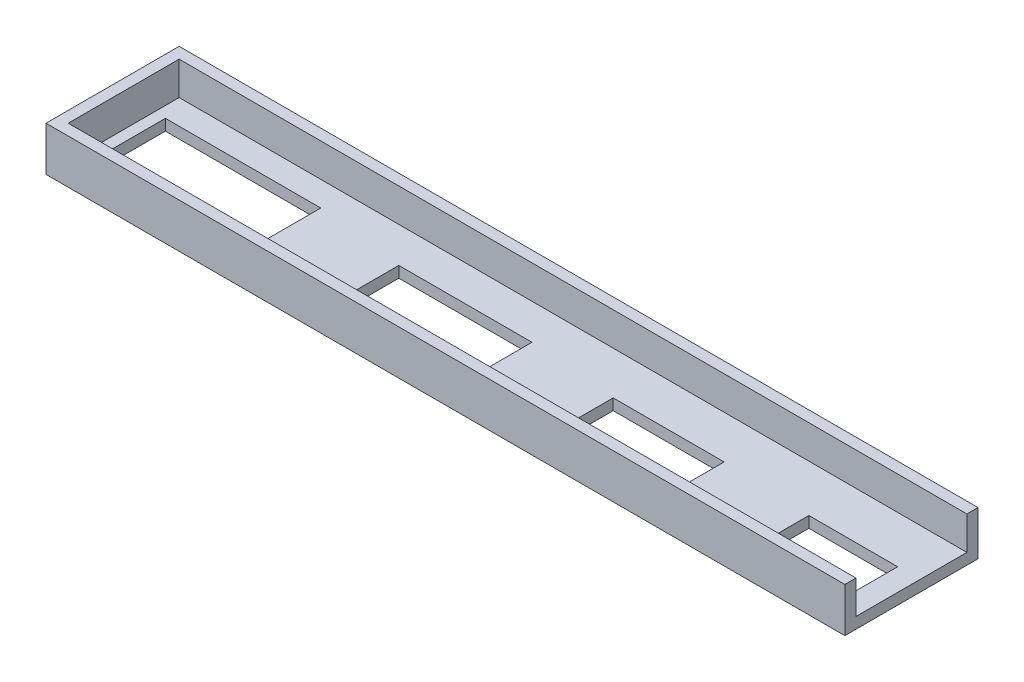
from build123d import *

# Parameters (mm, degrees)
SKETCH1_W           = 228.6
SKETCH1_H           = 38.1
BOSS_EXTRUDE1_DEPTH = 12.7
SHELL1_T            = -3.175
SKETCH3_W           = 3.175
SKETCH3_H           = 31.75
CUT_EXTRUDE1_DEPTH  = 9.525
SKETCH4_W           = 25.4
SKETCH4_H           = 16.383
SKETCH4_W_2         = 31.75
SKETCH4_H_2         = 17.526
SKETCH4_W_3         = 38.1
SKETCH4_H_3         = 19.685
SKETCH4_W_4         = 44.45
SKETCH4_H_4         = 22.733
CUT_EXTRUDE2_DEPTH  = 232.948907359


with BuildPart() as part:
    # Sketch1 → Boss-Extrude1 (new body)
    with BuildSketch(Plane(origin=(0, 0, 0), x_dir=(1, 0, 0), z_dir=(0, 1, 0))):
        with Locations((114.3, 19.05)):
            Rectangle(SKETCH1_W, SKETCH1_H)
    extrude(amount=-BOSS_EXTRUDE1_DEPTH)

    # Shell1
    shell1_openings = [part.faces().sort_by_distance(p)[0] for p in [
        (114.3, 0, -19.05),
    ]]
    offset(amount=SHELL1_T, openings=shell1_openings, kind=Kind.INTERSECTION)

    # Sketch3 → Cut-Extrude1 (cut)
    with BuildSketch(Plane(origin=(0, 0, 0), x_dir=(1, 0, 0), z_dir=(0, 1, 0))):
        with Locations((227.0125, 19.05)):
            Rectangle(SKETCH3_W, SKETCH3_H)
    extrude(amount=-CUT_EXTRUDE1_DEPTH, mode=Mode.SUBTRACT)

    # Sketch4 → Cut-Extrude2 (cut, through all)
    with BuildSketch(Plane(origin=(0, -9.525, 0), x_dir=(1, 0, 0), z_dir=(0, 1, 0))):
        with Locations((209.55, 13.2715)):
            Rectangle(SKETCH4_W, SKETCH4_H)
        with Locations((155.575, 13.843)):
            Rectangle(SKETCH4_W_2, SKETCH4_H_2)
        with Locations((95.25, 14.9225)):
            Rectangle(SKETCH4_W_3, SKETCH4_H_3)
        with Locations((28.575, 16.4465)):
            Rectangle(SKETCH4_W_4, SKETCH4_H_4)
    extrude(amount=-CUT_EXTRUDE2_DEPTH, mode=Mode.SUBTRACT)


solid = part.part
